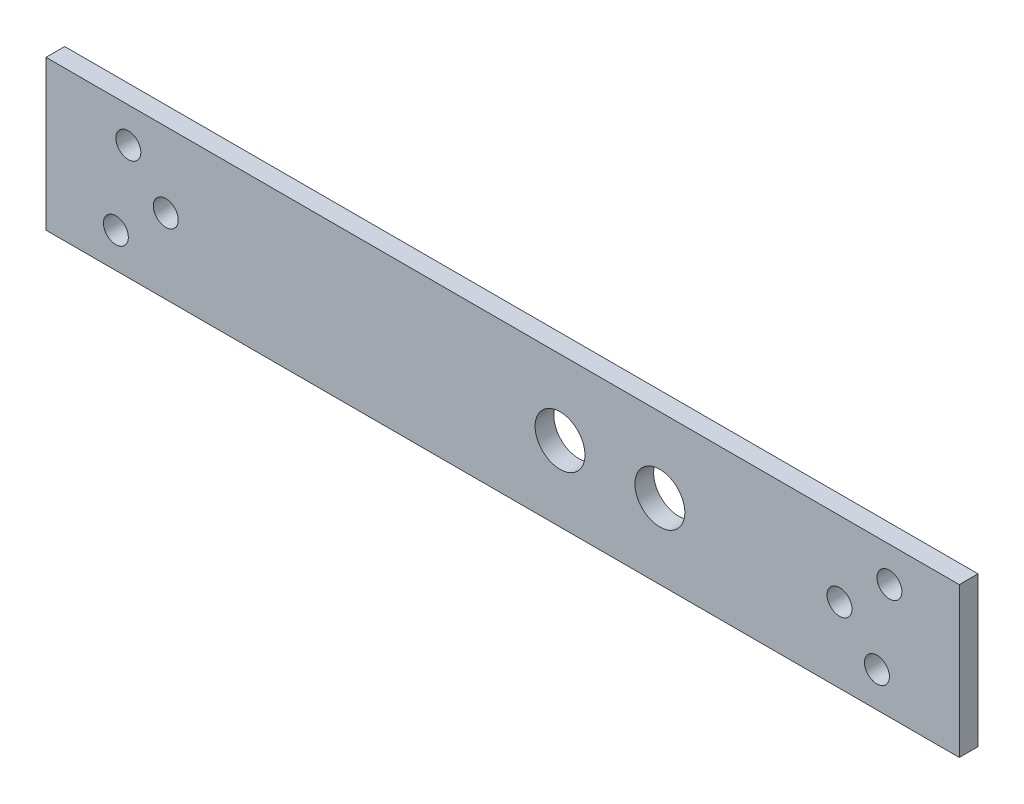
from build123d import *

# Parameters (mm, degrees)
SKETCH1_W           = 232.41
SKETCH1_H           = 38.1
SKETCH1_R           = 3.175
SKETCH1_R_2         = 6.35
BOSS_EXTRUDE1_DEPTH = 4.7625


with BuildPart() as part:
    # Sketch1 → Boss-Extrude1 (new body)
    with BuildSketch(Plane.XY):
        with Locations((116.205, 19.05)):
            Rectangle(SKETCH1_W, SKETCH1_H)
        with Locations(Location((30.48, 19.05, 0), (0, 0, 180))):
            Circle(SKETCH1_R, mode=Mode.SUBTRACT)
        with Locations(Location((156.21, 19.05, 0), (0, 0, 180))):
            Circle(SKETCH1_R_2, mode=Mode.SUBTRACT)
        with Locations(Location((20.955, 29.21, 0), (0, 0, 180))):
            Circle(SKETCH1_R, mode=Mode.SUBTRACT)
        with Locations(Location((17.78, 8.89, 0), (0, 0, 180))):
            Circle(SKETCH1_R, mode=Mode.SUBTRACT)
        with Locations(Location((214.63, 29.21, 0), (0, 0, 180))):
            Circle(SKETCH1_R, mode=Mode.SUBTRACT)
        with Locations(Location((201.93, 19.05, 0), (0, 0, 180))):
            Circle(SKETCH1_R, mode=Mode.SUBTRACT)
        with Locations(Location((211.455, 8.89, 0), (0, 0, 180))):
            Circle(SKETCH1_R, mode=Mode.SUBTRACT)
        with Locations(Location((130.81, 19.05, 0), (0, 0, 180))):
            Circle(SKETCH1_R_2, mode=Mode.SUBTRACT)
    extrude(amount=BOSS_EXTRUDE1_DEPTH)


solid = part.part
